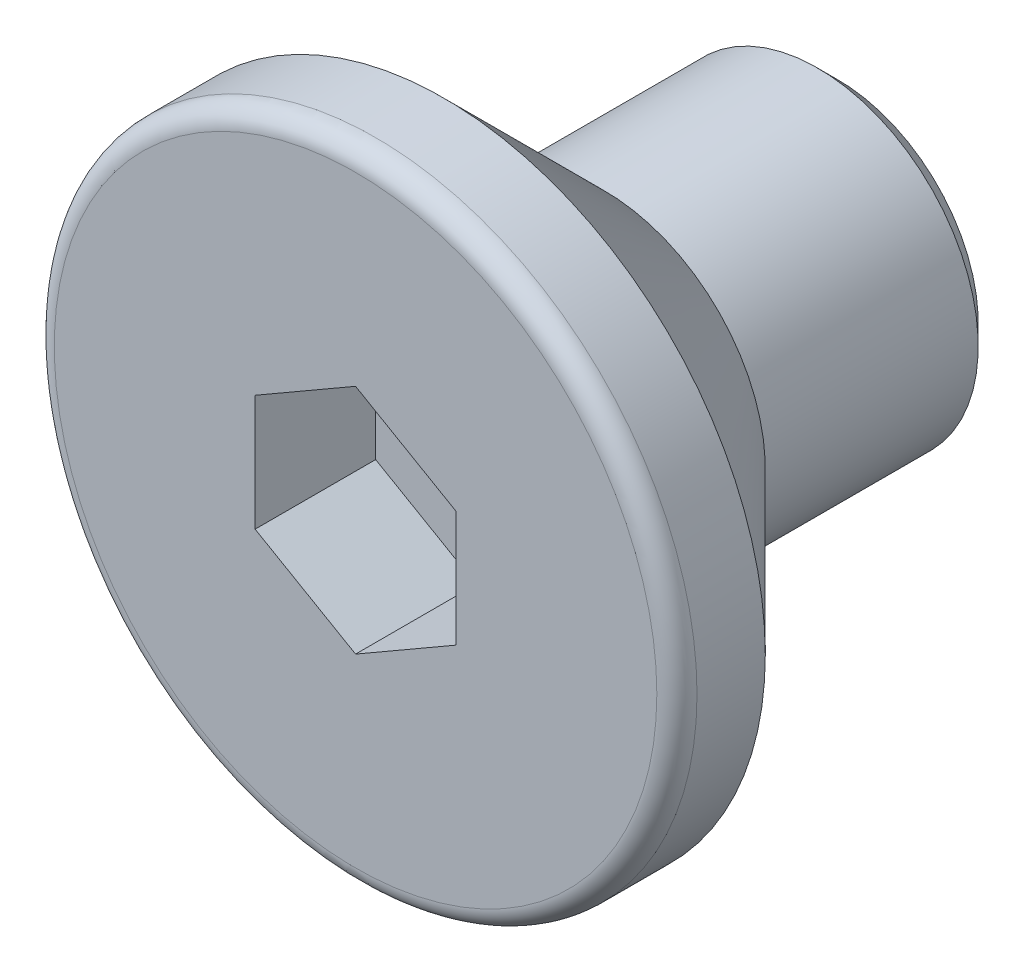
from build123d import *

# Parameters (mm, degrees)
CUT_EXTRUDE_1_DEPTH = 3
FILLET_1_R          = 0.5
CHAMFER_1_SIZE      = 0.5


with BuildPart() as part:
    # 草图1 → 旋转1 (revolve)
    with BuildSketch(Plane(origin=(0, 0, 0), x_dir=(0, 0, -1), z_dir=(1, 0, 0)), mode=Mode.PRIVATE) as revolve_1_sk:
        Polygon((-6, 0), (-6, 8), (-3.8, 8), (0.2, 4), (6, 4), (6, 0), align=None)
    revolve(revolve_1_sk.sketch.rotate(Axis((0, 0, -6), (0, 0, 1)), 90), axis=Axis((0, 0, -6), (0, 0, 1)))

    # 草图2 → 切除-拉伸1 (cut)
    with BuildSketch(Plane.XY.offset(6)):
        Polygon((0, 2.886751346), (-2.5, 1.443375673), (-2.5, -1.443375673), (0, -2.886751346), (2.5, -1.443375673), (2.5, 1.443375673), align=None)
    extrude(amount=-CUT_EXTRUDE_1_DEPTH, mode=Mode.SUBTRACT)

    # 圆角1
    fillet_1_edges = [part.edges().sort_by_distance(p)[0] for p in [
        (8, 0, 6),
    ]]
    fillet(fillet_1_edges, radius=FILLET_1_R)

    # 倒角1
    chamfer_1_edges = [part.edges().sort_by_distance(p)[0] for p in [
        (4, 0, -6),
    ]]
    chamfer(chamfer_1_edges, length=CHAMFER_1_SIZE)


solid = part.part
